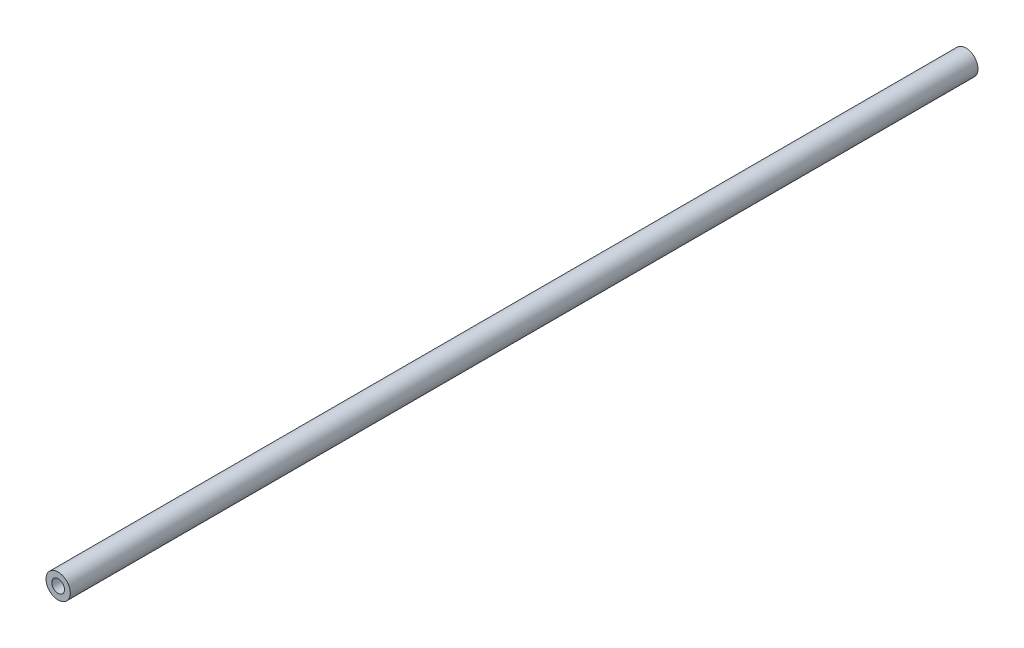
from build123d import *

# Parameters (mm, degrees)
SKETCH1_R           = 4.7625
SKETCH1_R_2         = 2.4892
BOSS_EXTRUDE1_DEPTH = 177.8


with BuildPart() as part:
    # Sketch1 → Boss-Extrude1 (new, symmetric)
    with BuildSketch(Plane.XY):
        Circle(SKETCH1_R)
        Circle(SKETCH1_R_2, mode=Mode.SUBTRACT)
    extrude(amount=BOSS_EXTRUDE1_DEPTH, both=True)


solid = part.part
